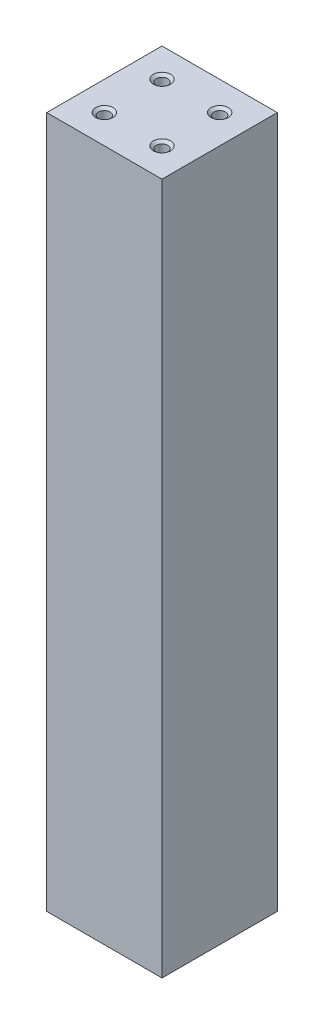
from build123d import *

# Parameters (mm, degrees)
SKETCH1_W                        = 50.8
SKETCH1_H                        = 50.8
BOSS_EXTRUDE1_DEPTH              = 304.8
F_1_4_20_TAPPED_HOLE1_AT_2_COUNT = 2
F_1_4_20_TAPPED_HOLE1_AT_2_PITCH = 25.4
F_1_4_20_TAPPED_HOLE1_AT_3_COUNT = 2
F_1_4_20_TAPPED_HOLE1_AT_3_PITCH = 35.921024484
F_1_4_20_TAPPED_HOLE1_AT_4_COUNT = 2
F_1_4_20_TAPPED_HOLE1_AT_4_PITCH = 25.4


with BuildPart() as part:
    # Sketch1 → Boss-Extrude1 (new body)
    with BuildSketch(Plane(origin=(0, 0, 0), x_dir=(1, 0, 0), z_dir=(0, 1, 0))):
        Rectangle(SKETCH1_W, SKETCH1_H)
    extrude(amount=BOSS_EXTRUDE1_DEPTH)

    # Sketch3 → 1/4-20 Tapped Hole1 (revolve, cut)
    with BuildSketch(Plane(origin=(-12.7, 304.8, -12.7), x_dir=(0, 0, 1), z_dir=(1, 0, 0))):
        Polygon((0, 0), (0, 26.933816902), (2.5527, 25.4), (2.5527, 1.054999966), (3.81, 0), align=None)
    f_1_4_20_tapped_hole1 = revolve(axis=Axis((-12.7, 311.15, -12.7), (0, -1, 0)), mode=Mode.SUBTRACT)

    # 1/4-20 Tapped Hole1 at 2: 1/4-20 Tapped Hole1 ×2
    with Locations(*[(i * F_1_4_20_TAPPED_HOLE1_AT_2_PITCH, 0, 0) for i in range(1, F_1_4_20_TAPPED_HOLE1_AT_2_COUNT)]):
        add(f_1_4_20_tapped_hole1, mode=Mode.SUBTRACT)

    # 1/4-20 Tapped Hole1 at 3: 1/4-20 Tapped Hole1 ×2
    with Locations(*[Vector(0.7071067811865476, 0, 0.7071067811865475) * (i * F_1_4_20_TAPPED_HOLE1_AT_3_PITCH) for i in range(1, F_1_4_20_TAPPED_HOLE1_AT_3_COUNT)]):
        add(f_1_4_20_tapped_hole1, mode=Mode.SUBTRACT)

    # 1/4-20 Tapped Hole1 at 4: 1/4-20 Tapped Hole1 ×2
    with Locations(*[(0, 0, i * F_1_4_20_TAPPED_HOLE1_AT_4_PITCH) for i in range(1, F_1_4_20_TAPPED_HOLE1_AT_4_COUNT)]):
        add(f_1_4_20_tapped_hole1, mode=Mode.SUBTRACT)

    # Mirror1: 1/4-20 Tapped Hole1 across plane
    add(f_1_4_20_tapped_hole1.mirror(Plane(origin=(0, 152.4, 0), x_dir=(0, 0, 1), z_dir=(0, -1, 0))), mode=Mode.SUBTRACT)

    # Mirror1 copy 1 sketch → Mirror1 copy 1 (revolve, cut)
    with BuildSketch(Plane(origin=(12.7, 0, -12.7), x_dir=(0, 0, 1), z_dir=(1, 0, 0))):
        Polygon((0, 0), (0, -26.933816902), (2.5527, -25.4), (2.5527, -1.054999966), (3.81, 0), align=None)
    revolve(axis=Axis((12.7, -6.35, -12.7), (0, -1, 0)), mode=Mode.SUBTRACT)

    # Mirror1 copy 2 sketch → Mirror1 copy 2 (revolve, cut)
    with BuildSketch(Plane(origin=(12.7, 0, 12.7), x_dir=(0, 0, 1), z_dir=(1, 0, 0))):
        Polygon((0, 0), (0, -26.933816902), (2.5527, -25.4), (2.5527, -1.054999966), (3.81, 0), align=None)
    revolve(axis=Axis((12.7, -6.35, 12.7), (0, -1, 0)), mode=Mode.SUBTRACT)

    # Mirror1 copy 3 sketch → Mirror1 copy 3 (revolve, cut)
    with BuildSketch(Plane(origin=(-12.7, 0, 12.7), x_dir=(0, 0, 1), z_dir=(1, 0, 0))):
        Polygon((0, 0), (0, -26.933816902), (2.5527, -25.4), (2.5527, -1.054999966), (3.81, 0), align=None)
    revolve(axis=Axis((-12.7, -6.35, 12.7), (0, -1, 0)), mode=Mode.SUBTRACT)


solid = part.part
